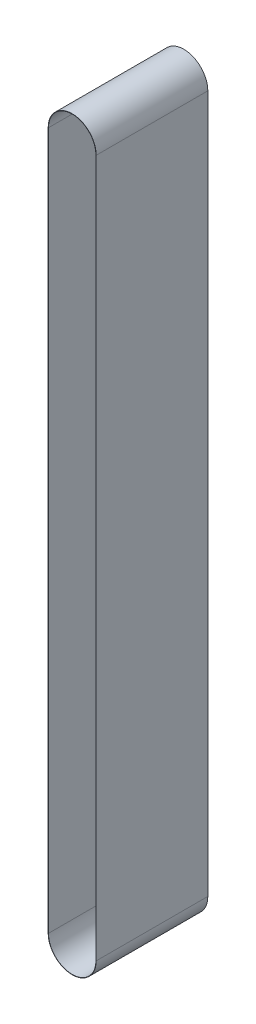
from build123d import *

# Parameters (mm, degrees)
BOSS_EXTRUDE1_DEPTH = 40
SKETCH3_W           = 10
SKETCH3_H           = 10
CUT_EXTRUDE1_DEPTH  = 5


with BuildPart() as part:
    # Sketch1 → Boss-Extrude1 (new, symmetric)
    with BuildSketch(Plane.XY):
        with BuildLine():
            Line((-17.2, -250), (-17.2, 250))
            ThreePointArc((-17.2, 250), (0, 267.2), (17.2, 250))
            Line((17.2, 250), (17.2, -250))
            ThreePointArc((17.2, -250), (0, -267.2), (-17.2, -250))
        make_face()
        with BuildLine():
            Line((-17, -250), (-17, 250))
            ThreePointArc((-17, 250), (0, 267), (17, 250))
            Line((17, 250), (17, -250))
            ThreePointArc((17, -250), (0, -267), (-17, -250))
        make_face(mode=Mode.SUBTRACT)
    extrude(amount=BOSS_EXTRUDE1_DEPTH, both=True)

    # Sketch3 → Cut-Extrude1 (cut, symmetric)
    with BuildSketch(Plane.XY):
        with Locations((0, -267)):
            Rectangle(SKETCH3_W, SKETCH3_H)
    extrude(amount=CUT_EXTRUDE1_DEPTH, both=True, mode=Mode.SUBTRACT)


solid = part.part
